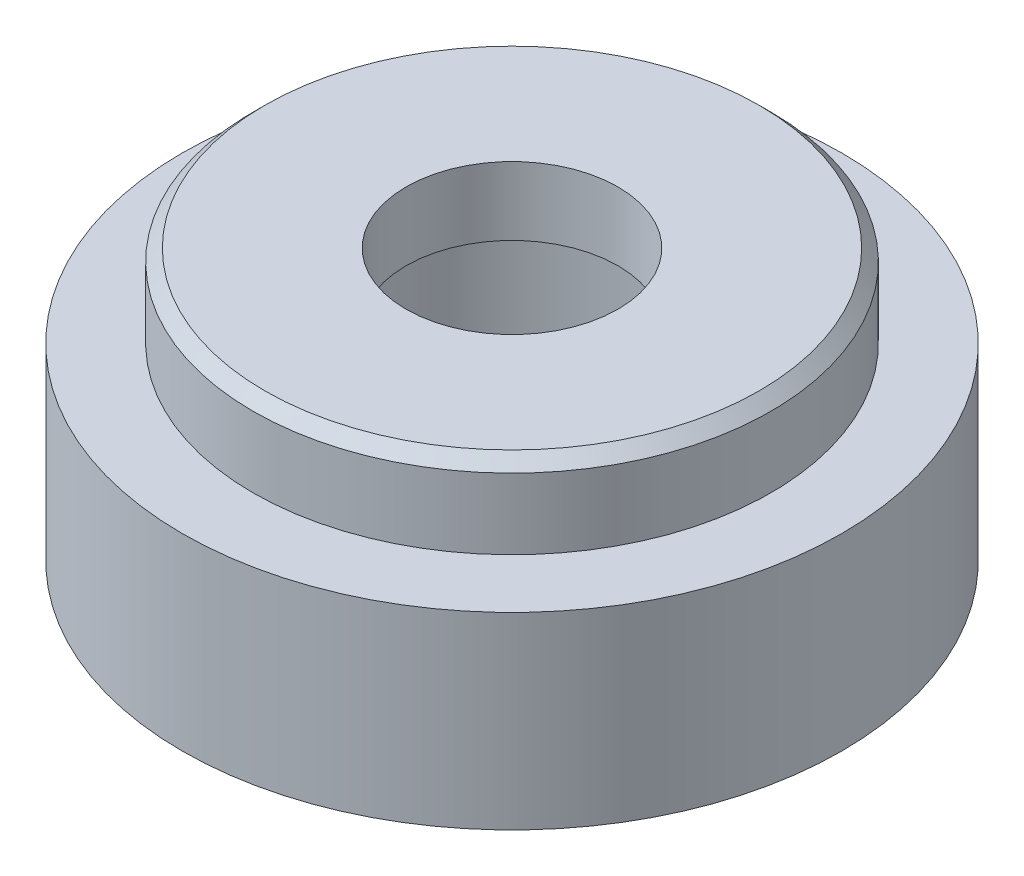
from build123d import *

# Parameters (mm, degrees)
SKETCH_1_R                   = 14
EXTRUDE_1_DEPTH              = 8
SKETCH_2_R                   = 11
EXTRUDE_2_DEPTH              = 3.5
HOLE_WIZARD_M8_1_D           = 9
HOLE_WIZARD_M8_1_CBORE_D     = 15
HOLE_WIZARD_M8_1_CBORE_DEPTH = 8.6
CHAMFER_1_SIZE               = 0.5


with BuildPart() as part:
    # 草圖1 → 填料-伸長1 (new body)
    with BuildSketch(Plane(origin=(0, 0, 0), x_dir=(1, 0, 0), z_dir=(0, 1, 0))):
        with Locations(Location((0, 0, 0), (0, 0, 270))):
            Circle(SKETCH_1_R)
    extrude(amount=EXTRUDE_1_DEPTH)

    # 草圖2 → 填料-伸長2 (add)
    with BuildSketch(Plane(origin=(0, 8, 0), x_dir=(1, 0, 0), z_dir=(0, 1, 0))):
        with Locations(Location((0, 0, 0), (0, 0, 270))):
            Circle(SKETCH_2_R)
    extrude(amount=EXTRUDE_2_DEPTH)

    # M8 六角承窩頭蓋螺釘的柱孔1 (through all)
    with Locations(Plane(origin=(0, 0, 0), x_dir=(-1, 0, 0), z_dir=(0, -1, 0))):
        with Locations((0, 0)):
            CounterBoreHole(HOLE_WIZARD_M8_1_D / 2, HOLE_WIZARD_M8_1_CBORE_D / 2, HOLE_WIZARD_M8_1_CBORE_DEPTH)

    # 導角1
    chamfer_1_edges = [part.edges().sort_by_distance(p)[0] for p in [
        (0, 11.5, -11),
    ]]
    chamfer(chamfer_1_edges, length=CHAMFER_1_SIZE)


solid = part.part
